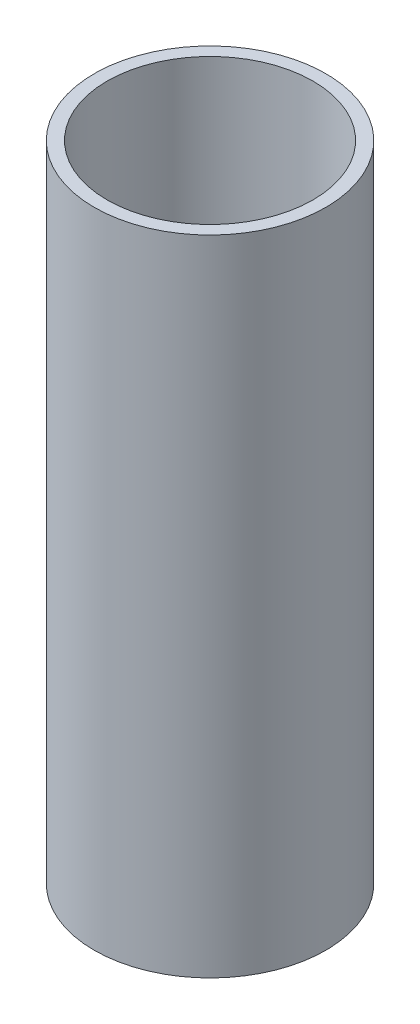
from build123d import *

# Parameters (mm, degrees)
SKETCH1_R           = 45
SKETCH1_R_2         = 40
BOSS_EXTRUDE1_DEPTH = 250


with BuildPart() as part:
    # Sketch1 → Boss-Extrude1 (new body)
    with BuildSketch(Plane(origin=(0, 0, 0), x_dir=(1, 0, 0), z_dir=(0, 1, 0))):
        with Locations(Location((0, 0, 0), (0, 0, 270))):
            Circle(SKETCH1_R)
        with Locations(Location((0, 0, 0), (0, 0, 270))):
            Circle(SKETCH1_R_2, mode=Mode.SUBTRACT)
    extrude(amount=BOSS_EXTRUDE1_DEPTH)


solid = part.part
